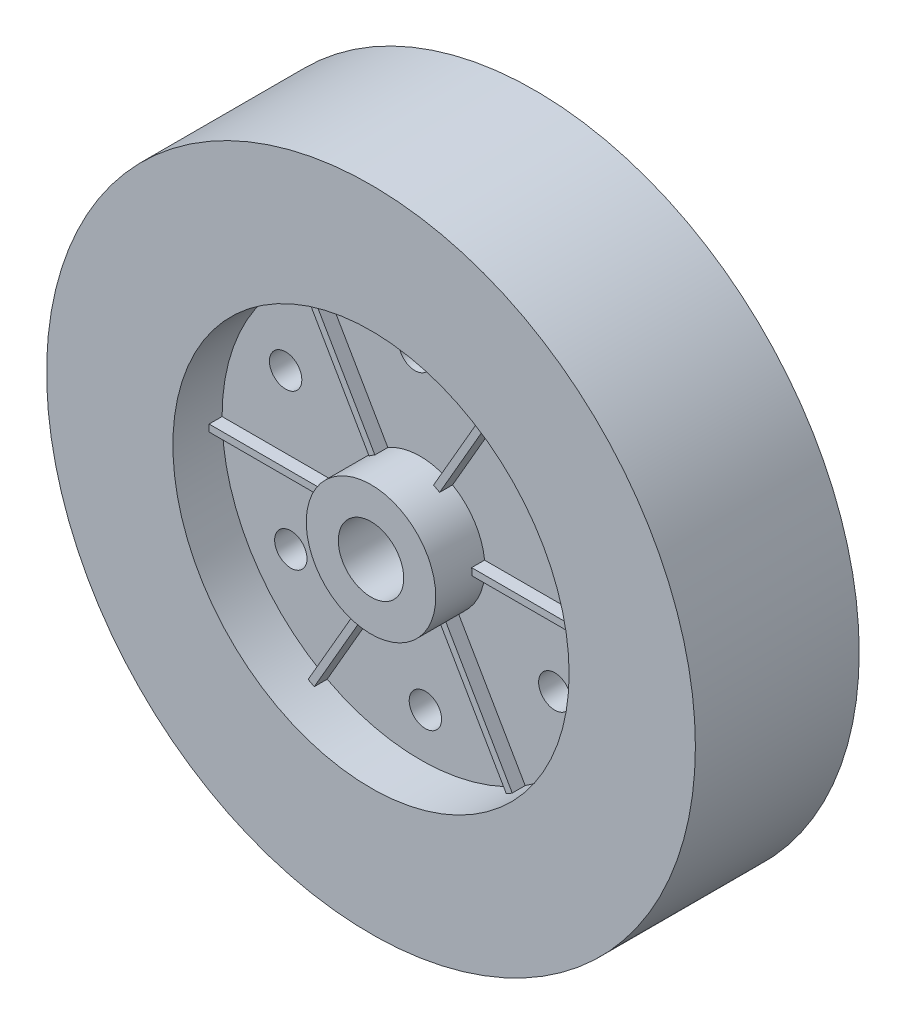
from build123d import *

# Parameters (mm, degrees)
SKETCH1_R           = 50.1
BOSS_EXTRUDE5_DEPTH = 25.3
SKETCH4_R           = 30.6
CUT_EXTRUDE1_DEPTH  = 7.6
CUT_EXTRUDE2_START  = -7.6
SKETCH5_R           = 30.6
CUT_EXTRUDE2_DEPTH  = 7.6
SKETCH6_R           = 10
BOSS_EXTRUDE7_DEPTH = 7.6
SKETCH7_R           = 5.05
CUT_EXTRUDE5_DEPTH  = 10000
BOSS_EXTRUDE8_START = 2
BOSS_EXTRUDE8_DEPTH = 2
SKETCH9_R           = 2.5
CUT_EXTRUDE11_DEPTH = 74.029514581


with BuildPart() as part:
    # Sketch1 → Boss-Extrude5 (new body)
    with BuildSketch(Plane.XY):
        Circle(SKETCH1_R)
    extrude(amount=BOSS_EXTRUDE5_DEPTH)

    # Sketch4 → Cut-Extrude1 (cut)
    with BuildSketch(Plane.XY.offset(25.3)):
        Circle(SKETCH4_R)
    extrude(amount=-CUT_EXTRUDE1_DEPTH, mode=Mode.SUBTRACT)

    # Sketch5 → Cut-Extrude2 (cut)
    with BuildSketch(Plane(origin=(0, 0, 0), x_dir=(-1, 0, 0), z_dir=(0, 0, -1)).offset(CUT_EXTRUDE2_START)):
        with Locations(Location((0, 0, 0), (0, 0, 180))):
            Circle(SKETCH5_R)
    extrude(amount=CUT_EXTRUDE2_DEPTH, mode=Mode.SUBTRACT)

    # Sketch6 → Boss-Extrude7 (add)
    with BuildSketch(Plane.XY.offset(17.7)):
        with Locations(Location((0, 0, 0), (0, 0, 180))):
            Circle(SKETCH6_R)
    extrude(amount=BOSS_EXTRUDE7_DEPTH)

    # Sketch7 → Cut-Extrude5 (cut)
    with BuildSketch(Plane.XY.offset(25.3)):
        Circle(SKETCH7_R)
    extrude(amount=-CUT_EXTRUDE5_DEPTH, mode=Mode.SUBTRACT)

    # Sketch8 → Boss-Extrude8 (add)
    with BuildSketch(Plane.XY.offset(17.7).offset(BOSS_EXTRUDE8_START)):
        with BuildLine():
            Line((-30.6, 0), (-10, 0))
            ThreePointArc((-10, 0), (-9.985723513, -0.534159082), (-9.942934815, -1.066792981))
            Line((-9.942934815, -1.066792981), (-30.581398803, -1.066792981))
            ThreePointArc((-30.581398803, -1.066792981), (-30.595349347, -0.53347757), (-30.6, 0))
        make_face()
        with BuildLine():
            Line((-16.214569224, 25.950871756), (-5.89533723, 8.077437647))
            ThreePointArc((-5.89533723, 8.077437647), (-5.455457091, 8.380810696), (-5, 8.660254038))
            Line((-5, 8.660254038), (-15.3, 26.500377356))
            ThreePointArc((-15.3, 26.500377356), (-15.759679801, 26.229610988), (-16.214569224, 25.950871756))
        make_face()
        with BuildLine():
            Line((14.366829579, 27.017664737), (4.047597585, 9.144230629))
            ThreePointArc((4.047597585, 9.144230629), (4.530266422, 8.914969778), (5, 8.660254038))
            Line((5, 8.660254038), (15.3, 26.500377356))
            ThreePointArc((15.3, 26.500377356), (14.835669546, 26.763088557), (14.366829579, 27.017664737))
        make_face()
        with BuildLine():
            Line((30.581398803, 1.066792981), (9.942934815, 1.066792981))
            ThreePointArc((9.942934815, 1.066792981), (9.985723513, 0.534159082), (10, 0))
            Line((10, 0), (30.6, 0))
            ThreePointArc((30.6, 0), (30.595349347, 0.53347757), (30.581398803, 1.066792981))
        make_face()
        with BuildLine():
            Line((16.214569224, -25.950871756), (5.89533723, -8.077437647))
            ThreePointArc((5.89533723, -8.077437647), (5.455457091, -8.380810696), (5, -8.660254038))
            Line((5, -8.660254038), (15.3, -26.500377356))
            ThreePointArc((15.3, -26.500377356), (15.759679801, -26.229610988), (16.214569224, -25.950871756))
        make_face()
        with BuildLine():
            Line((-14.366829579, -27.017664737), (-4.047597585, -9.144230629))
            ThreePointArc((-4.047597585, -9.144230629), (-4.530266422, -8.914969778), (-5, -8.660254038))
            Line((-5, -8.660254038), (-15.3, -26.500377356))
            ThreePointArc((-15.3, -26.500377356), (-14.835669546, -26.763088557), (-14.366829579, -27.017664737))
        make_face()
    extrude(amount=-BOSS_EXTRUDE8_DEPTH)

    # Sketch9 → Cut-Extrude11 (cut, through all)
    with BuildSketch(Plane.XY.offset(7.6)):
        with Locations((-19.982206185, -12.462368817)):
            Circle(SKETCH9_R)
        with Locations((-20.783831079, 11.073913771)):
            Circle(SKETCH9_R)
        with Locations((-0.801624894, 23.536282588)):
            Circle(SKETCH9_R)
        with Locations((19.982206185, 12.462368817)):
            Circle(SKETCH9_R)
        with Locations((20.783831079, -11.073913771)):
            Circle(SKETCH9_R)
        with Locations((0.801624894, -23.536282588)):
            Circle(SKETCH9_R)
    extrude(amount=CUT_EXTRUDE11_DEPTH, mode=Mode.SUBTRACT)


solid = part.part
